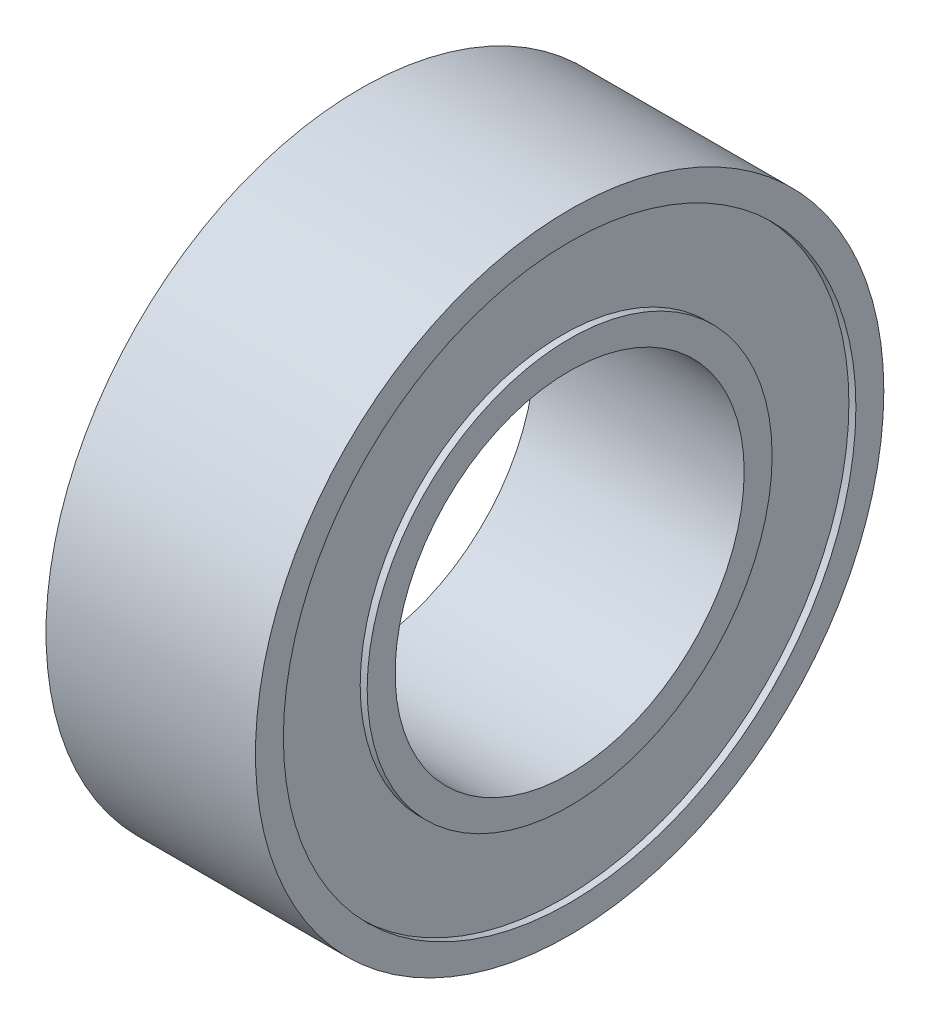
from build123d import *

# Parameters (mm, degrees)
SKETCH1_R           = 4.5
SKETCH1_R_2         = 2.5
BOSS_EXTRUDE1_DEPTH = 3
SKETCH2_R           = 4.1
SKETCH2_R_2         = 2.9
CUT_EXTRUDE1_DEPTH  = 0.1
CUT_EXTRUDE2_START  = -0.1
SKETCH3_R           = 4.1
SKETCH3_R_2         = 2.9
CUT_EXTRUDE2_DEPTH  = 0.1


with BuildPart() as part:
    # Sketch1 → Boss-Extrude1 (new body)
    with BuildSketch(Plane(origin=(0, 0, 0), x_dir=(0, 0, -1), z_dir=(1, 0, 0))):
        Circle(SKETCH1_R)
        Circle(SKETCH1_R_2, mode=Mode.SUBTRACT)
    extrude(amount=BOSS_EXTRUDE1_DEPTH)

    # Sketch2 → Cut-Extrude1 (cut)
    with BuildSketch(Plane(origin=(3, 0, 0), x_dir=(0, 0, -1), z_dir=(1, 0, 0))):
        Circle(SKETCH2_R)
        Circle(SKETCH2_R_2, mode=Mode.SUBTRACT)
    extrude(amount=-CUT_EXTRUDE1_DEPTH, mode=Mode.SUBTRACT)

    # Sketch3 → Cut-Extrude2 (cut)
    with BuildSketch(Plane.ZY.offset(CUT_EXTRUDE2_START)):
        with Locations(Location((0, 0, 0), (0, 0, 180))):
            Circle(SKETCH3_R)
        with Locations(Location((0, 0, 0), (0, 0, 180))):
            Circle(SKETCH3_R_2, mode=Mode.SUBTRACT)
    extrude(amount=CUT_EXTRUDE2_DEPTH, mode=Mode.SUBTRACT)


solid = part.part
